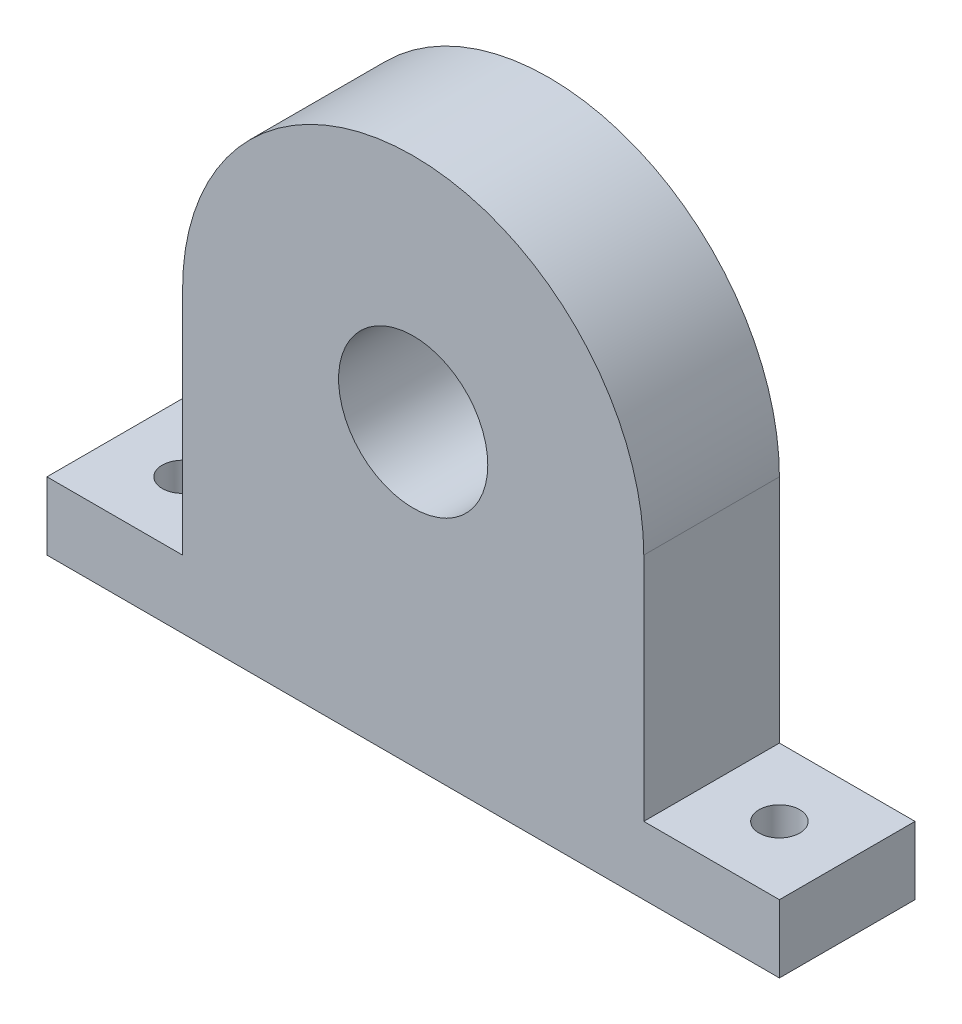
from build123d import *

# Parameters (mm, degrees)
SKETCH_3_R               = 5.5
EXTRUDE_1_DEPTH          = 10
SKETCH_4_R               = 1.5
CUT_EXTRUDE_1_DEPTH      = 45.55333882
CUT_EXTRUDE_2_DEPTH      = 45.55333882
CUT_EXTRUDE_2_DEPTH_BACK = 45.55333882
SKETCH_5_R               = 1.5


with BuildPart() as part:
    # Эскиз3 → Бобышка-Вытянуть1 (new body)
    with BuildSketch(Plane.XY):
        with BuildLine():
            Line((-17, 0), (-17, -17))
            Line((-17, -17), (-27, -17))
            Line((-27, -17), (-27, -22))
            Line((-27, -22), (27, -22))
            Line((27, -22), (27, -17))
            Line((27, -17), (17, -17))
            Line((17, -17), (17, 0))
            ThreePointArc((17, 0), (0, 17), (-17, 0))
        make_face()
        Circle(SKETCH_3_R, mode=Mode.SUBTRACT)
    extrude(amount=EXTRUDE_1_DEPTH)

    # Эскиз4 → Вырез-Вытянуть1 (cut, through all)
    with BuildSketch(Plane(origin=(0, -17, 0), x_dir=(1, 0, 0), z_dir=(0, 1, 0))):
        with Locations(Location((22, -5, 0), (0, 0, 270))):
            Circle(SKETCH_4_R)
    extrude(amount=-CUT_EXTRUDE_1_DEPTH, mode=Mode.SUBTRACT)

    # Эскиз5 → Вырез-Вытянуть2 (cut, two sides: drawn at the far end of the back side and taken through both)
    with BuildSketch(Plane(origin=(0, -17, 0), x_dir=(1, 0, 0), z_dir=(0, 1, 0)).offset(-CUT_EXTRUDE_2_DEPTH_BACK)):
        with Locations(Location((-22, -5, 0), (0, 0, 270))):
            Circle(SKETCH_5_R)
    extrude(amount=CUT_EXTRUDE_2_DEPTH + CUT_EXTRUDE_2_DEPTH_BACK, mode=Mode.SUBTRACT)


solid = part.part
